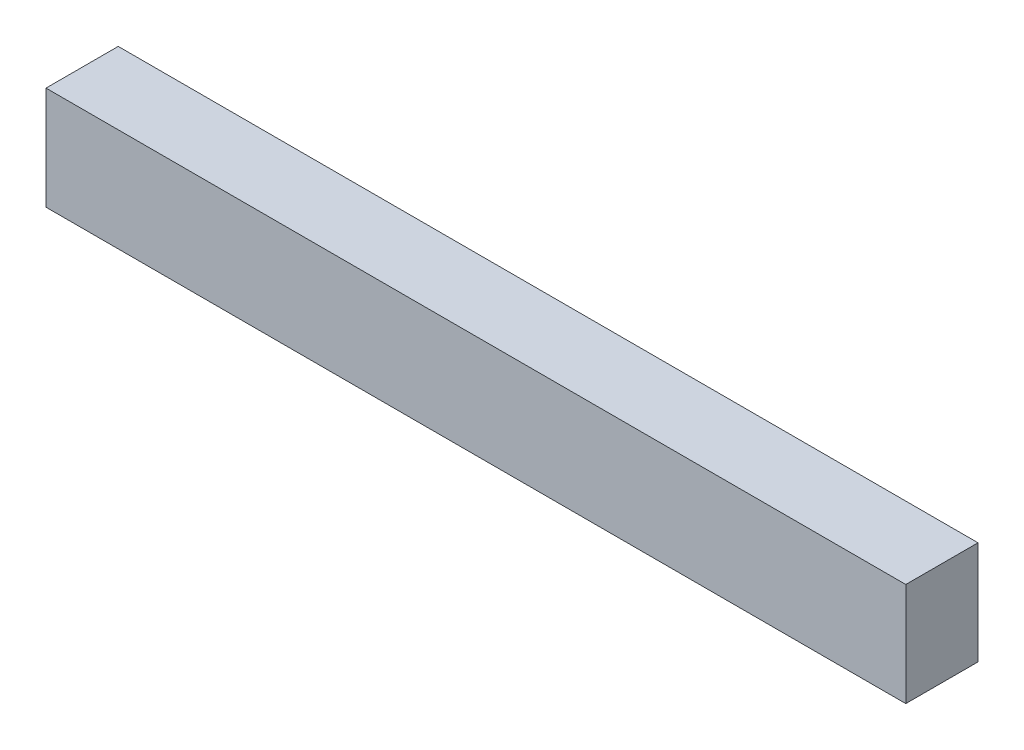
from build123d import *

# Parameters (mm, degrees)
SKETCH1_W           = 63.5
SKETCH1_H           = 7.62
BOSS_EXTRUDE1_DEPTH = 5.334


with BuildPart() as part:
    # Sketch1 → Boss-Extrude1 (new body)
    with BuildSketch(Plane.XY):
        with Locations((-17.950766538, 9.69950632)):
            Rectangle(SKETCH1_W, SKETCH1_H)
    extrude(amount=BOSS_EXTRUDE1_DEPTH)


solid = part.part
